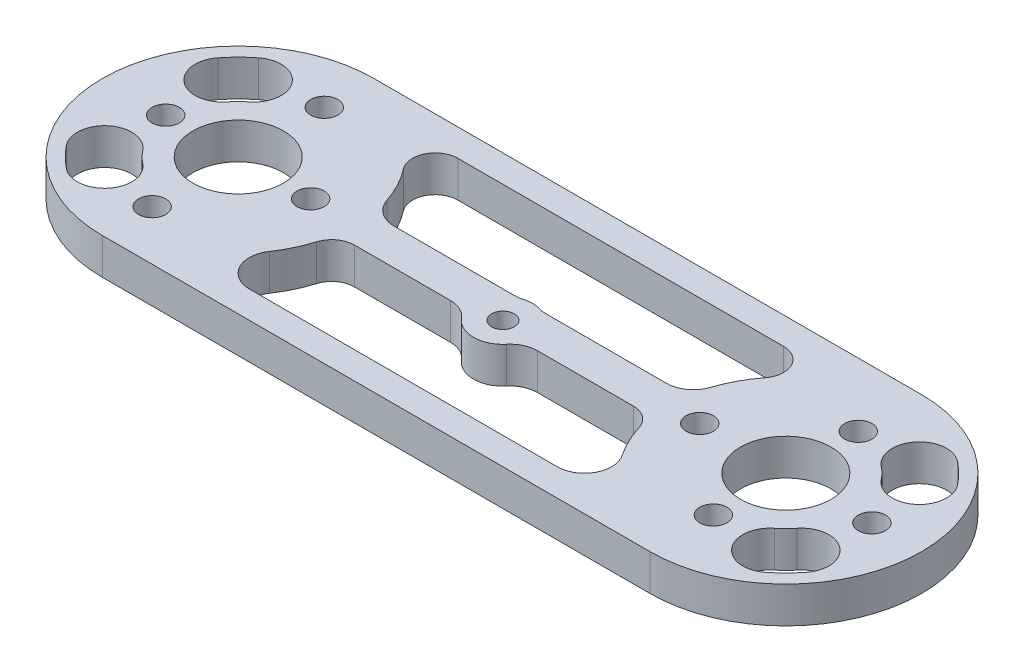
from build123d import *

# Parameters (mm, degrees)
SKETCH_1_R          = 5
SKETCH_1_R_2        = 1.5
SKETCH_1_R_3        = 1.25
EXTRUDE_1_DEPTH     = 4
CUT_EXTRUDE_1_DEPTH = 10
FILLET_1_R          = 2.5
FILLET_2_R          = 3
CUT_EXTRUDE_2_DEPTH = 10
CHAMFER_1_SIZE      = 1.5


with BuildPart() as part:
    # 草图1 → 凸台-拉伸1 (new body)
    with BuildSketch(Plane(origin=(0, 0, 0), x_dir=(1, 0, 0), z_dir=(0, 1, 0))):
        with BuildLine():
            Line((-30.225, 15), (30.225, 15))
            ThreePointArc((30.225, 15), (45.225, 0), (30.225, -15))
            Line((30.225, -15), (-30.225, -15))
            ThreePointArc((-30.225, -15), (-45.225, 0), (-30.225, 15))
        make_face()
        with Locations(Location((-30.225, 0, 0), (0, 0, 270))):
            Circle(SKETCH_1_R, mode=Mode.SUBTRACT)
        with Locations(Location((30.225, 0, 0), (0, 0, 90))):
            Circle(SKETCH_1_R, mode=Mode.SUBTRACT)
        with Locations(Location((-30.225, 9.5, 0), (0, 0, 270))):
            Circle(SKETCH_1_R_2, mode=Mode.SUBTRACT)
        with Locations(Location((-30.225, -9.5, 0), (0, 0, 90))):
            Circle(SKETCH_1_R_2, mode=Mode.SUBTRACT)
        with Locations(Location((-38.225, 0, 0), (0, 0, 270))):
            Circle(SKETCH_1_R_2, mode=Mode.SUBTRACT)
        with Locations(Location((-22.225, 0, 0), (0, 0, 90))):
            Circle(SKETCH_1_R_2, mode=Mode.SUBTRACT)
        with Locations(Location((30.225, 8, 0), (0, 0, 270))):
            Circle(SKETCH_1_R_2, mode=Mode.SUBTRACT)
        with Locations(Location((20.725, 0, 0), (0, 0, 270))):
            Circle(SKETCH_1_R_2, mode=Mode.SUBTRACT)
        with Locations(Location((39.725, 0, 0), (0, 0, 90))):
            Circle(SKETCH_1_R_2, mode=Mode.SUBTRACT)
        with Locations(Location((30.225, -8, 0), (0, 0, 90))):
            Circle(SKETCH_1_R_2, mode=Mode.SUBTRACT)
        with Locations(Location((0, -1, 0), (0, 0, 270))):
            Circle(SKETCH_1_R_3, mode=Mode.SUBTRACT)
    extrude(amount=EXTRUDE_1_DEPTH)

    # 草图2 → 切除-拉伸1 (cut)
    with BuildSketch(Plane(origin=(0, 4, 0), x_dir=(1, 0, 0), z_dir=(0, 1, 0))):
        with BuildLine():
            Line((-3.092329219, -2), (-17.379767421, -2))
            ThreePointArc((-17.379767421, -2), (-19.996946351, -8.02414597), (-25.225, -12))
            Line((-25.225, -12), (25.225, -12))
            ThreePointArc((25.225, -12), (19.996946351, -8.02414597), (17.379767421, -2))
            Line((17.379767421, -2), (3.092329219, -2))
            ThreePointArc((3.092329219, -2), (0, -4.25), (-3.092329219, -2))
        make_face()
        with BuildLine():
            Line((-17.379767421, 2), (-1.25, 2))
            ThreePointArc((-1.25, 2), (0, 2.25), (1.25, 2))
            Line((1.25, 2), (17.379767421, 2))
            ThreePointArc((17.379767421, 2), (19.996946351, 8.02414597), (25.225, 12))
            Line((25.225, 12), (-25.225, 12))
            ThreePointArc((-25.225, 12), (-19.996946351, 8.02414597), (-17.379767421, 2))
        make_face()
    extrude(amount=-CUT_EXTRUDE_1_DEPTH, mode=Mode.SUBTRACT)

    # 圆角1
    fillet_1_edges = [part.edges().sort_by_distance(p)[0] for p in [
        (-25.225, 2, -12),
        (25.225, 2, -12),
        (17.379767421, 2, 2),
        (-17.379767421, 2, 2),
    ]]
    fillet(fillet_1_edges, radius=FILLET_1_R)

    # 圆角2
    fillet_2_edges = [part.edges().sort_by_distance(p)[0] for p in [
        (1.25, 2, -2),
        (-1.25, 2, -2),
        (-17.379767421, 2, -2),
        (17.379767421, 2, -2),
        (-3.092329219, 2, 2),
        (3.092329219, 2, 2),
        (25.225, 2, 12),
        (-25.225, 2, 12),
    ]]
    fillet(fillet_2_edges, radius=FILLET_2_R)

    # 草图3 → 切除-拉伸2 (cut)
    with BuildSketch(Plane(origin=(0, 4, 0), x_dir=(1, 0, 0), z_dir=(0, 1, 0))):
        with BuildLine():
            ThreePointArc((-34.867857143, 5.890150894), (-34.368939643, 10.103354108), (-38.582142857, 10.602271609))
            ThreePointArc((-38.582142857, 10.602271609), (-39.770941546, 9.545941546), (-40.827271609, 8.357142857))
            ThreePointArc((-40.827271609, 8.357142857), (-40.328354108, 4.143939643), (-36.115150894, 4.642857143))
            ThreePointArc((-36.115150894, 4.642857143), (-35.528300859, 5.303300859), (-34.867857143, 5.890150894))
        make_face()
        with BuildLine():
            ThreePointArc((-40.827271609, -8.357142857), (-39.770941546, -9.545941546), (-38.582142857, -10.602271609))
            ThreePointArc((-38.582142857, -10.602271609), (-34.368939643, -10.103354108), (-34.867857143, -5.890150894))
            ThreePointArc((-34.867857143, -5.890150894), (-35.528300859, -5.303300859), (-36.115150894, -4.642857143))
            ThreePointArc((-36.115150894, -4.642857143), (-40.328354108, -4.143939643), (-40.827271609, -8.357142857))
        make_face()
        with BuildLine():
            ThreePointArc((38.582142857, -10.602271609), (39.770941546, -9.545941546), (40.827271609, -8.357142857))
            ThreePointArc((40.827271609, -8.357142857), (40.328354108, -4.143939643), (36.115150894, -4.642857143))
            ThreePointArc((36.115150894, -4.642857143), (35.528300859, -5.303300859), (34.867857143, -5.890150894))
            ThreePointArc((34.867857143, -5.890150894), (34.368939643, -10.103354108), (38.582142857, -10.602271609))
        make_face()
        with BuildLine():
            ThreePointArc((40.827271609, 8.357142857), (39.770941546, 9.545941546), (38.582142857, 10.602271609))
            ThreePointArc((38.582142857, 10.602271609), (34.368939643, 10.103354108), (34.867857143, 5.890150894))
            ThreePointArc((34.867857143, 5.890150894), (35.528300859, 5.303300859), (36.115150894, 4.642857143))
            ThreePointArc((36.115150894, 4.642857143), (40.328354108, 4.143939643), (40.827271609, 8.357142857))
        make_face()
    extrude(amount=-CUT_EXTRUDE_2_DEPTH, mode=Mode.SUBTRACT)

    # 倒角1
    chamfer_1_edges = [part.edges().sort_by_distance(p)[0] for p in [
        (0, 0, -0.25),
    ]]
    chamfer(chamfer_1_edges, length=CHAMFER_1_SIZE)


solid = part.part
